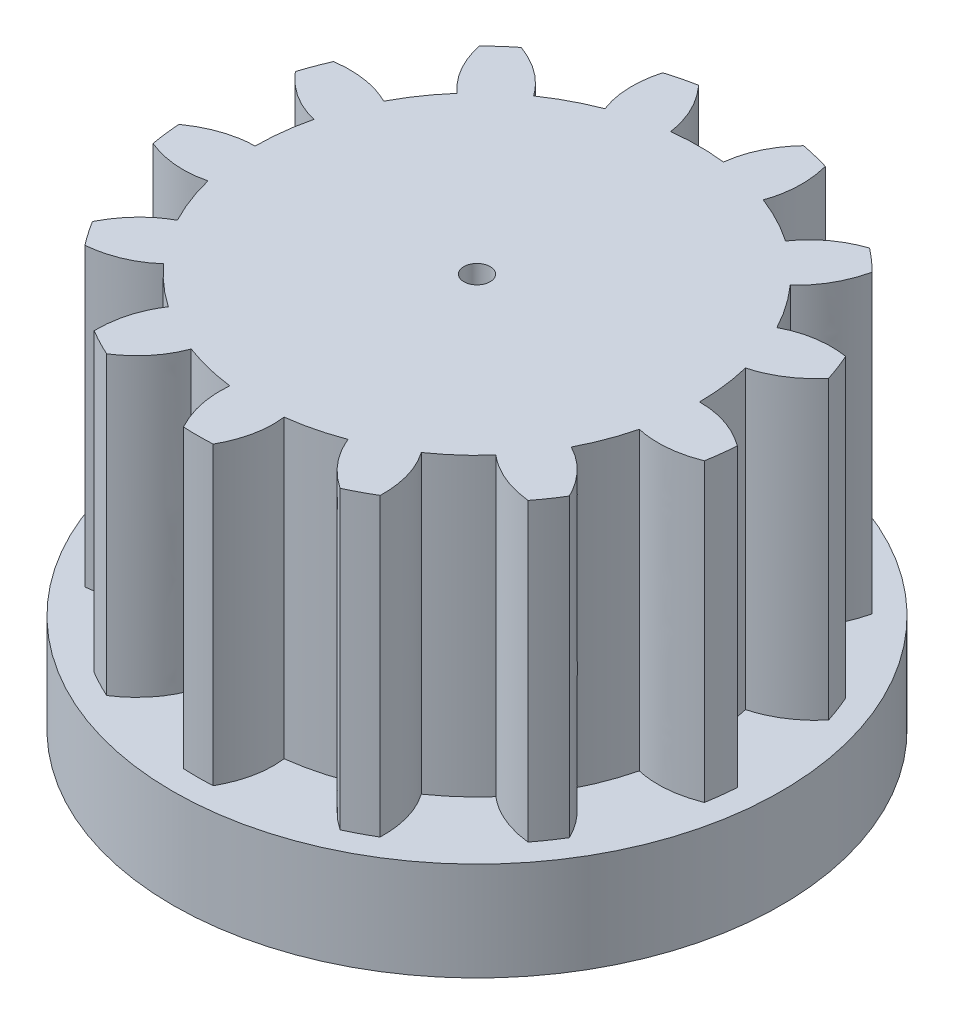
from build123d import *

# Parameters (mm, degrees)
SKETCH1_R           = 0.4
BOSS_EXTRUDE1_DEPTH = 9
SKETCH2_R           = 9.25
BOSS_EXTRUDE2_DEPTH = 3


with BuildPart() as part:
    # Sketch1 → Boss-Extrude1 (new body)
    with BuildSketch(Plane(origin=(0, 0, 0), x_dir=(1, 0, 0), z_dir=(0, 1, 0))):
        with BuildLine():
            add(Edge.make_bspline(
                [(-5.065227978, 4.461610195), (-5.526615005, 4.86619147), (-5.830003112, 5.39406146), (-5.975392301, 6.045220165)],
                knots=[0, 0, 0, 0, 0.872429449, 0.872429449, 0.872429449, 0.872429449], degree=3))
            ThreePointArc((-5.065227978, 4.461610195), (-5.560258819, 3.827012132), (-5.976238464, 3.138004752))
            add(Edge.make_bspline(
                [(-7.780961116, 3.42149735), (-7.125870497, 3.507536778), (-6.52429628, 3.413039245), (-5.976238464, 3.138004752)],
                knots=[0.127683247, 0.127683247, 0.127683247, 0.127683247, 1, 1, 1, 1], degree=3))
            ThreePointArc((-7.780961116, 3.42149735), (-7.951879756, 3.00293329), (-8.10030101, 2.575873357))
            add(Edge.make_bspline(
                [(-6.558450277, 1.596630818), (-7.155006493, 1.740452504), (-7.668956737, 2.066866683), (-8.10030101, 2.575873357)],
                knots=[0, 0, 0, 0, 0.872429449, 0.872429449, 0.872429449, 0.872429449], degree=3))
            ThreePointArc((-6.558450277, 1.596630818), (-6.701865893, 0.804669837), (-6.749999881, 0.00126872))
            add(Edge.make_bspline(
                [(-8.479748007, -0.586407486), (-7.939678588, -0.205787566), (-7.363095879, -0.009895497), (-6.749999881, 0.00126872)],
                knots=[0.127683247, 0.127683247, 0.127683247, 0.127683247, 1, 1, 1, 1], degree=3))
            ThreePointArc((-8.479748007, -0.586407486), (-8.436572529, -1.036457408), (-8.369528376, -1.483574994))
            add(Edge.make_bspline(
                [(-6.549210655, -1.634117437), (-7.144272221, -1.784003157), (-7.751044795, -1.733822342), (-8.369528376, -1.483574994)],
                knots=[0, 0, 0, 0, 0.872429449, 0.872429449, 0.872429449, 0.872429449], degree=3))
            ThreePointArc((-6.549210655, -1.634117437), (-6.308156258, -2.402012621), (-5.977417671, -3.13575796))
            add(Edge.make_bspline(
                [(-7.235926822, -4.459973434), (-6.934601997, -3.871968458), (-6.515098947, -3.4305633), (-5.977417671, -3.13575796)],
                knots=[0.127683247, 0.127683247, 0.127683247, 0.127683247, 1, 1, 1, 1], degree=3))
            ThreePointArc((-7.235926822, -4.459973434), (-6.988548208, -4.838408204), (-6.721397655, -5.203154193))
            add(Edge.make_bspline(
                [(-5.039625799, -4.490509081), (-5.496871281, -4.899765193), (-6.0574619, -5.137313564), (-6.721397655, -5.203154193)],
                knots=[0, 0, 0, 0, 0.872429449, 0.872429449, 0.872429449, 0.872429449], degree=3))
            ThreePointArc((-5.039625799, -4.490509081), (-4.469324045, -5.058422935), (-3.835481109, -5.554420281))
            add(Edge.make_bspline(
                [(-4.334442004, -7.311813216), (-4.34089166, -6.651128039), (-4.174571361, -6.065330394), (-3.835481109, -5.554420281)],
                knots=[0.127683247, 0.127683247, 0.127683247, 0.127683247, 1, 1, 1, 1], degree=3))
            ThreePointArc((-4.334442004, -7.311813216), (-3.939531713, -7.53193799), (-3.533475733, -7.730753472))
            add(Edge.make_bspline(
                [(-2.375523406, -6.318179211), (-2.590203375, -6.893050073), (-2.976187484, -7.36390816), (-3.533475733, -7.730753472)],
                knots=[0, 0, 0, 0, 0.872429449, 0.872429449, 0.872429449, 0.872429449], degree=3))
            ThreePointArc((-2.375523406, -6.318179211), (-1.606623554, -6.556009515), (-0.814882047, -6.700631854))
            add(Edge.make_bspline(
                [(-0.439988759, -8.488604708), (-0.752735357, -7.906594341), (-0.877699786, -7.31060339), (-0.814882047, -6.700631854)],
                knots=[0.127683247, 0.127683247, 0.127683247, 0.127683247, 1, 1, 1, 1], degree=3))
            ThreePointArc((-0.439988759, -8.488604708), (0.011984021, -8.499991552), (0.463922896, -8.487330296))
            add(Edge.make_bspline(
                [(0.832782771, -6.698430626), (0.909848909, -7.307220251), (0.786895617, -7.903520141), (0.463922896, -8.487330296)],
                knots=[0, 0, 0, 0, 0.872429449, 0.872429449, 0.872429449, 0.872429449], degree=3))
            ThreePointArc((0.832782771, -6.698430626), (1.624135031, -6.551693323), (2.392396671, -6.311809421))
            add(Edge.make_bspline(
                [(3.555260608, -7.72075916), (3.007863545, -7.350755165), (2.620242233, -6.881105252), (2.392396671, -6.311809421)],
                knots=[0.127683247, 0.127683247, 0.127683247, 0.127683247, 1, 1, 1, 1], degree=3))
            ThreePointArc((3.555260608, -7.72075916), (3.96075436, -7.520799485), (4.355042381, -7.299562032))
            add(Edge.make_bspline(
                [(3.850308451, -5.54415231), (4.201465773, -6.047394331), (4.369710416, -6.632530905), (4.355042381, -7.299562032)],
                knots=[0, 0, 0, 0, 0.872429449, 0.872429449, 0.872429449, 0.872429449], degree=3))
            ThreePointArc((3.850308451, -5.54415231), (4.482823853, -5.046463148), (5.051606144, -4.477027515))
            add(Edge.make_bspline(
                [(6.736042616, -5.184180734), (6.079397157, -5.110946566), (5.517918333, -4.875228826), (5.051606144, -4.477027515)],
                knots=[0.127683247, 0.127683247, 0.127683247, 0.127683247, 1, 1, 1, 1], degree=3))
            ThreePointArc((6.736042616, -5.184180734), (7.002163607, -4.818682892), (7.24847414, -4.439552076))
            add(Edge.make_bspline(
                [(5.985774866, -3.119775513), (6.530577461, -3.402183249), (6.951477219, -3.84210877), (7.24847414, -4.439552076)],
                knots=[0, 0, 0, 0, 0.872429449, 0.872429449, 0.872429449, 0.872429449], degree=3))
            ThreePointArc((5.985774866, -3.119775513), (6.314551754, -2.385149082), (6.553553527, -1.616612559))
            add(Edge.make_bspline(
                [(8.373678438, -1.459968977), (7.758214146, -1.700281702), (7.151505842, -1.75249623), (6.553553527, -1.616612559)],
                knots=[0.127683247, 0.127683247, 0.127683247, 0.127683247, 1, 1, 1, 1], degree=3))
            ThreePointArc((8.373678438, -1.459968977), (8.439461558, -1.01266412), (8.481367828, -0.562494242))
            add(Edge.make_bspline(
                [(6.749972396, 0.019304256), (7.363612555, 0.022427015), (7.940744366, -0.171505818), (8.481367828, -0.562494242)],
                knots=[0, 0, 0, 0, 0.872429449, 0.872429449, 0.872429449, 0.872429449], degree=3))
            ThreePointArc((6.749972396, 0.019304256), (6.699691947, 0.822573894), (6.554160776, 1.614148852))
            add(Edge.make_bspline(
                [(8.093005444, 2.598704077), (7.65971777, 2.099897208), (7.146769547, 1.771712133), (6.554160776, 1.614148852)],
                knots=[0.127683247, 0.127683247, 0.127683247, 0.127683247, 1, 1, 1, 1], degree=3))
            ThreePointArc((8.093005444, 2.598704077), (7.943380571, 3.025343799), (7.771282357, 3.443424244))
            add(Edge.make_bspline(
                [(5.967832596, 3.153961653), (6.509732754, 3.44189952), (7.110882674, 3.53838705), (7.771282357, 3.443424244)],
                knots=[0, 0, 0, 0, 0.872429449, 0.872429449, 0.872429449, 0.872429449], degree=3))
            ThreePointArc((5.967832596, 3.153961653), (5.550013455, 3.841855105), (5.053288778, 4.475128213))
            add(Edge.make_bspline(
                [(5.958322434, 6.062045345), (5.806472362, 5.419014975), (5.504794477, 4.890042598), (5.053288778, 4.475128213)],
                knots=[0.127683247, 0.127683247, 0.127683247, 0.127683247, 1, 1, 1, 1], degree=3))
            ThreePointArc((5.958322434, 6.062045345), (5.627566824, 6.370281912), (5.280889753, 6.660495734))
            add(Edge.make_bspline(
                [(3.818534268, 5.566084444), (4.16455163, 6.072874324), (4.652003458, 6.437678087), (5.280889753, 6.660495734)],
                knots=[0, 0, 0, 0, 0.872429449, 0.872429449, 0.872429449, 0.872429449], degree=3))
            ThreePointArc((3.818534268, 5.566084444), (3.128893766, 5.98101361), (2.394769219, 6.310909632))
            add(Edge.make_bspline(
                [(2.45865956, 8.136645081), (2.623034112, 7.496701718), (2.601737332, 6.888123235), (2.394769219, 6.310909632)],
                knots=[0.127683247, 0.127683247, 0.127683247, 0.127683247, 1, 1, 1, 1], degree=3))
            ThreePointArc((2.45865956, 8.136645081), (2.022545337, 8.25586521), (1.580708948, 8.351727918))
            add(Edge.make_bspline(
                [(0.794455758, 6.703084368), (0.865321915, 7.312626807), (1.127406312, 7.862174657), (1.580708948, 8.351727918)],
                knots=[0, 0, 0, 0, 0.872429449, 0.872429449, 0.872429449, 0.872429449], degree=3))
            ThreePointArc((0.794455758, 6.703084368), (-0.009017778, 6.749993976), (-0.812363108, 6.700937709))
            add(Edge.make_bspline(
                [(-1.604252589, 8.347237485), (-1.161309642, 7.856984441), (-0.897346481, 7.308217849), (-0.812363108, 6.700937709)],
                knots=[0.127683247, 0.127683247, 0.127683247, 0.127683247, 1, 1, 1, 1], degree=3))
            ThreePointArc((-1.604252589, 8.347237485), (-2.045816912, 8.250129282), (-2.481593228, 8.129679886))
            add(Edge.make_bspline(
                [(-2.411622992, 6.304488444), (-2.632142622, 6.877144615), (-2.655466033, 7.485541762), (-2.481593228, 8.129679886)],
                knots=[0, 0, 0, 0, 0.872429449, 0.872429449, 0.872429449, 0.872429449], degree=3))
            ThreePointArc((-2.411622992, 6.304488444), (-3.144863458, 5.972632069), (-3.833392837, 5.555861712))
            add(Edge.make_bspline(
                [(-5.299649804, 6.645578377), (-4.679611352, 6.417326717), (-4.19085903, 6.054087828), (-3.833392837, 5.555861712)],
                knots=[0.127683247, 0.127683247, 0.127683247, 0.127683247, 1, 1, 1, 1], degree=3))
            ThreePointArc((-5.299649804, 6.645578377), (-5.645507162, 6.35438816), (-5.975392301, 6.045220165))
        make_face()
        with Locations(Location((0, 0, 0), (0, 0, 270))):
            Circle(SKETCH1_R, mode=Mode.SUBTRACT)
    extrude(amount=BOSS_EXTRUDE1_DEPTH)

    # Sketch2 → Boss-Extrude2 (add)
    with BuildSketch(Plane.XZ):
        with Locations(Location((0, 0, 0), (0, 0, 270))):
            Circle(SKETCH2_R)
    extrude(amount=BOSS_EXTRUDE2_DEPTH)


solid = part.part
